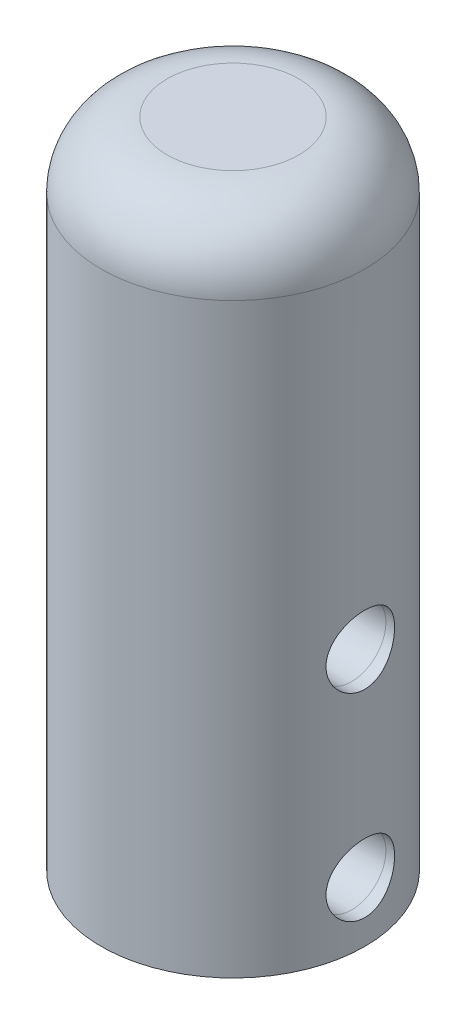
from build123d import *

# Parameters (mm, degrees)
SKETCH1_R                    = 10
BOSS_EXTRUDE1_DEPTH          = 24.5
BOSS_EXTRUDE2_START          = 25
SKETCH1_2_R                  = 10
BOSS_EXTRUDE2_DEPTH          = 25
FILLET1_R                    = 5
CUT_EXTRUDE1_DEPTH           = 127.123946973
CUT_EXTRUDE1_DEPTH_BACK      = 127.123946973
SKETCH2_R                    = 1.7
CUT_EXTRUDE2_START           = 5.5
SKETCH2_4_R                  = 2.6
CUT_EXTRUDE2_DEPTH           = 3.9
CUT_EXTRUDE2_TAPER           = 1.5
CUT_EXTRUDE2_OTHER_WAY_DEPTH = 127.123946991
CUT_EXTRUDE3_START           = -13.5
SKETCH3_R                    = 2.85
CUT_EXTRUDE3_DEPTH           = 3.5


with BuildPart() as part:
    # Sketch1 → Boss-Extrude1 (new body)
    with BuildSketch(Plane(origin=(0, 100, 0), x_dir=(1, 0, 0), z_dir=(0, 1, 0))):
        with Locations(Location((-23.645, 0, 0), (0, 0, 180))):
            Circle(SKETCH1_R)
        Polygon((-24.145, -4.4), (-19.745, -4.4), (-19.745, 4.4), (-24.145, 4.4), (-27.545, 4.4), (-27.545, -4.4), align=None, mode=Mode.SUBTRACT)
    extrude(amount=-BOSS_EXTRUDE1_DEPTH)

    # Sketch1<2> → Boss-Extrude2 (add)
    with BuildSketch(Plane(origin=(0, 100, 0), x_dir=(1, 0, 0), z_dir=(0, 1, 0)).offset(BOSS_EXTRUDE2_START)):
        with Locations(Location((-23.645, 0, 0), (0, 0, 180))):
            Circle(SKETCH1_2_R)
    extrude(amount=-BOSS_EXTRUDE2_DEPTH)

    # Fillet1
    fillet1_edges = [part.edges().sort_by_distance(p)[0] for p in [
        (-13.645, 125, 0),
    ]]
    fillet(fillet1_edges, radius=FILLET1_R)

    # Sketch2 → Cut-Extrude1 (cut, two sides: drawn at the far end of the back side and taken through both)
    with BuildSketch(Plane(origin=(-20.145, 0, 0), x_dir=(0, 0, -1), z_dir=(1, 0, 0)).offset(-CUT_EXTRUDE1_DEPTH_BACK)):
        with Locations(Location((0, 80, 0), (0, 0, 270))):
            Circle(SKETCH2_R)
        with Locations(Location((0, 95, 0), (0, 0, 270))):
            Circle(SKETCH2_R)
    extrude(amount=CUT_EXTRUDE1_DEPTH + CUT_EXTRUDE1_DEPTH_BACK, mode=Mode.SUBTRACT)

    # Sketch2<4> → Cut-Extrude2 (cut)
    with BuildSketch(Plane(origin=(-20.145, 0, 0), x_dir=(0, 0, -1), z_dir=(1, 0, 0)).offset(CUT_EXTRUDE2_START)):
        with Locations(Location((0, 95, 0), (0, 0, 90))):
            Circle(SKETCH2_4_R)
        with Locations(Location((0, 80, 0), (0, 0, 90))):
            Circle(SKETCH2_4_R)
    extrude(amount=-CUT_EXTRUDE2_DEPTH, taper=CUT_EXTRUDE2_TAPER, mode=Mode.SUBTRACT)

    # Sketch2<4> → Cut-Extrude2 other way (cut)
    with BuildSketch(Plane(origin=(-20.145, 0, 0), x_dir=(0, 0, -1), z_dir=(1, 0, 0)).offset(CUT_EXTRUDE2_START)):
        with Locations(Location((0, 95, 0), (0, 0, 90))):
            Circle(SKETCH2_4_R)
        with Locations(Location((0, 80, 0), (0, 0, 90))):
            Circle(SKETCH2_4_R)
    extrude(amount=CUT_EXTRUDE2_OTHER_WAY_DEPTH, mode=Mode.SUBTRACT)

    # Sketch3 → Cut-Extrude3 (cut)
    with BuildSketch(Plane(origin=(-20.145, 0, 0), x_dir=(0, 0, -1), z_dir=(1, 0, 0)).offset(CUT_EXTRUDE3_START)):
        with Locations(Location((0, 80, 0), (0, 0, 270))):
            Circle(SKETCH3_R)
        with Locations(Location((0, 95, 0), (0, 0, 270))):
            Circle(SKETCH3_R)
    extrude(amount=CUT_EXTRUDE3_DEPTH, mode=Mode.SUBTRACT)


solid = part.part
